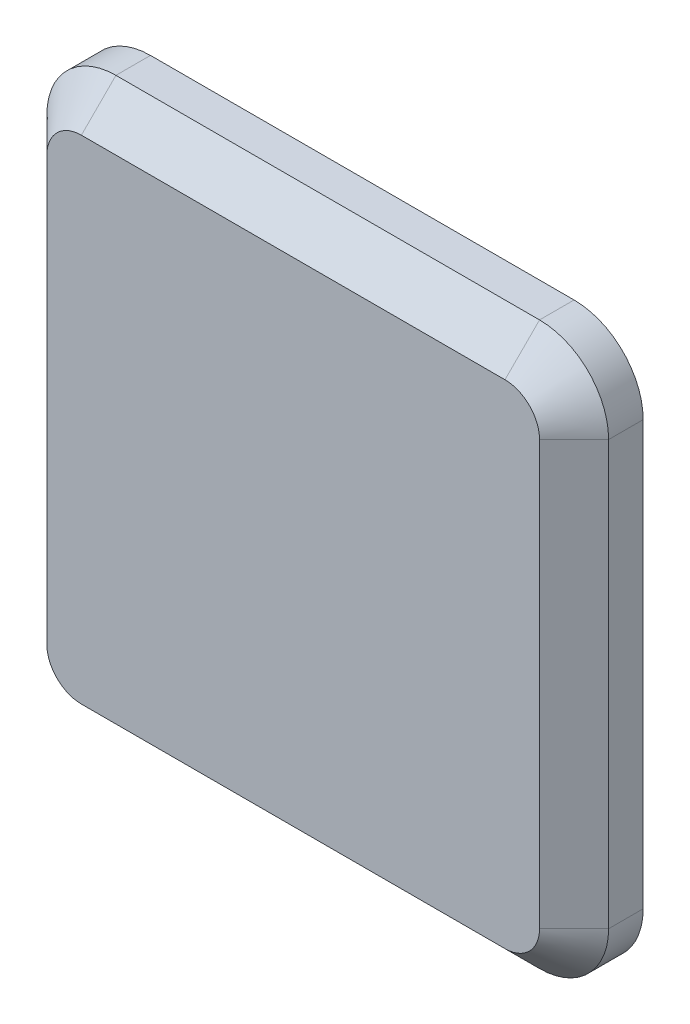
from build123d import *

# Parameters (mm, degrees)
SKETCH1_W           = 32.526911934
SKETCH1_H           = 32.526911934
BOSS_EXTRUDE1_DEPTH = 4
FILLET1_R           = 4
CHAMFER1_SIZE       = 2


with BuildPart() as part:
    # Sketch1 → Boss-Extrude1 (new body)
    with BuildSketch(Plane.XY):
        Rectangle(SKETCH1_W, SKETCH1_H)
    extrude(amount=BOSS_EXTRUDE1_DEPTH)

    # Fillet1
    fillet1_edges = [part.edges().sort_by_distance(p)[0] for p in [
        (-16.263455967, 16.263455967, 2),
        (16.263455967, 16.263455967, 2),
        (16.263455967, -16.263455967, 2),
        (-16.263455967, -16.263455967, 2),
    ]]
    fillet(fillet1_edges, radius=FILLET1_R)

    # Chamfer1
    chamfer1_edges = [part.edges().sort_by_distance(p)[0] for p in [
        (0, -16.263455967, 4),
        (-16.263455967, 0, 4),
        (16.263455967, 0, 4),
        (0, 16.263455967, 4),
        (-15.091883092, 15.091883092, 4),
        (15.091883092, 15.091883092, 4),
        (15.091883092, -15.091883092, 4),
        (-15.091883092, -15.091883092, 4),
    ]]
    chamfer(chamfer1_edges, length=CHAMFER1_SIZE)


solid = part.part
